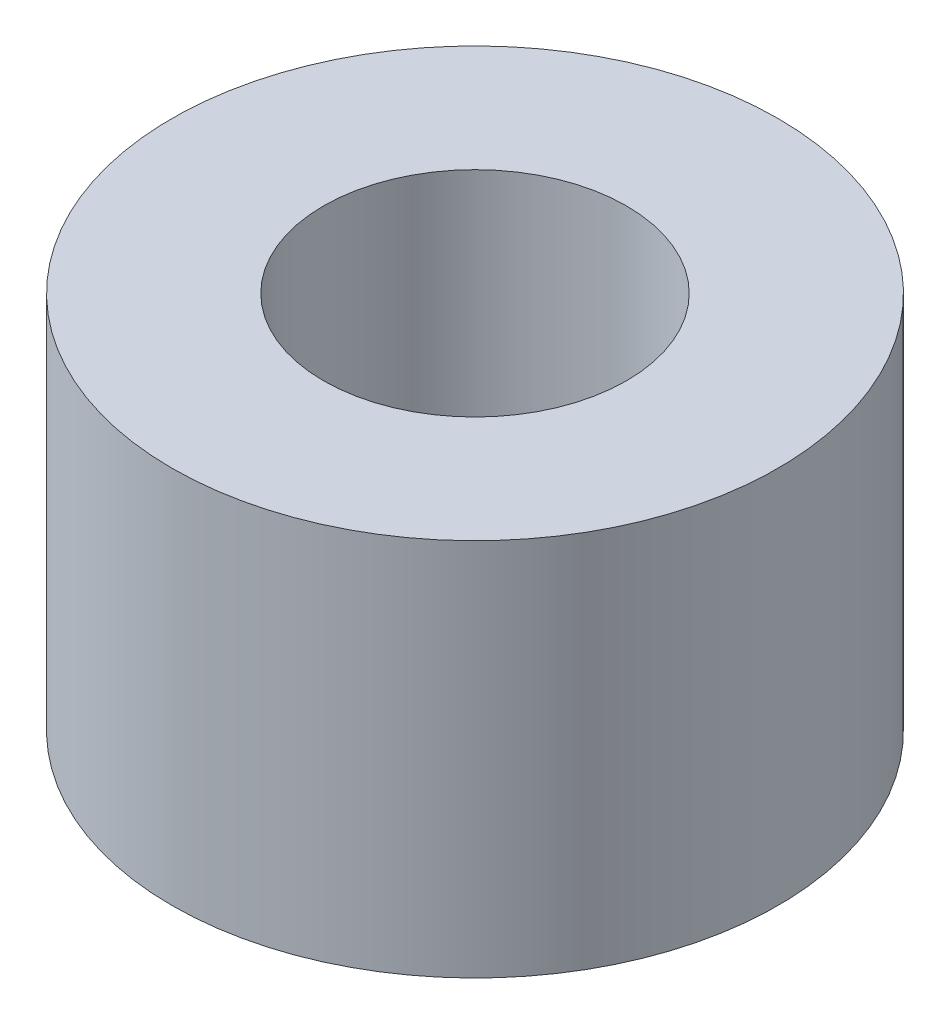
from build123d import *

# Parameters (mm, degrees)
ESQUISSE1_R        = 4
ESQUISSE1_R_2      = 2
BOSS_EXTRU_1_DEPTH = 5


with BuildPart() as part:
    # Esquisse1 → Boss.-Extru.1 (new body)
    with BuildSketch(Plane(origin=(0, 0, 0), x_dir=(1, 0, 0), z_dir=(0, 1, 0))):
        with Locations(Location((0, 0, 0), (0, 0, 270))):
            Circle(ESQUISSE1_R)
        with Locations(Location((0, 0, 0), (0, 0, 270))):
            Circle(ESQUISSE1_R_2, mode=Mode.SUBTRACT)
    extrude(amount=BOSS_EXTRU_1_DEPTH)


solid = part.part
